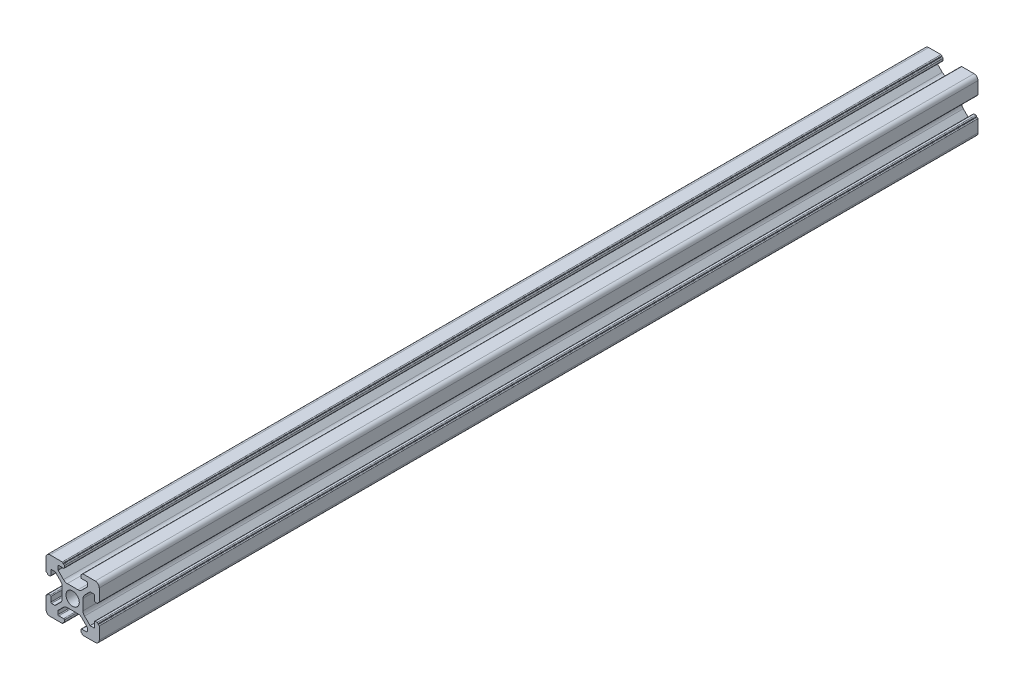
from build123d import *

# Parameters (mm, degrees)
SKETCH_191_R    = 2.5
EXTRUDE_1_DEPTH = 330


with BuildPart() as part:
    # Sketch 191 → 凸台-拉伸1 (new body)
    with BuildSketch(Plane.XY):
        with BuildLine():
            Line((3961.92734864, 92.136143898), (3963.914354409, 94.123149666))
            ThreePointArc((3963.914354409, 94.123149666), (3964.011681414, 94.188181491), (3964.126486443, 94.211017632))
            Line((3964.126486443, 94.211017632), (3965.341562203, 94.211017632))
            ThreePointArc((3965.341562203, 94.211017632), (3965.553694237, 94.123149666), (3965.641562203, 93.911017632))
            Line((3965.641562203, 93.911017632), (3965.641562203, 92.111017631))
            ThreePointArc((3965.641562203, 92.111017631), (3965.729430168, 91.898885597), (3965.941562203, 91.811017632))
            Line((3965.941562203, 91.811017632), (3966.641562203, 91.811017632))
            ThreePointArc((3966.641562203, 91.811017632), (3966.853694237, 91.898885597), (3966.941562203, 92.111017632))
            Line((3966.941562203, 92.111017632), (3966.941562203, 92.311017632))
            Line((3966.941562203, 92.311017632), (3967.141562203, 92.311017632))
            ThreePointArc((3967.141562203, 92.311017632), (3967.353694237, 92.398885597), (3967.441562203, 92.611017632))
            Line((3967.441562203, 92.611017632), (3967.441562203, 97.211017632))
            ThreePointArc((3967.441562203, 97.211017632), (3967.002222375, 98.271677803), (3965.941562203, 98.711017632))
            Line((3965.941562203, 98.711017632), (3961.341562203, 98.711017632))
            ThreePointArc((3961.341562203, 98.711017632), (3961.129430168, 98.623149666), (3961.041562203, 98.411017632))
            Line((3961.041562203, 98.411017632), (3961.041562203, 98.211017632))
            Line((3961.041562203, 98.211017632), (3960.841562203, 98.211017632))
            ThreePointArc((3960.841562203, 98.211017632), (3960.629430168, 98.123149666), (3960.541562203, 97.911017632))
            Line((3960.541562203, 97.911017632), (3960.541562203, 97.211017631))
            ThreePointArc((3960.541562203, 97.211017631), (3960.629430168, 96.998885597), (3960.841562203, 96.911017632))
            Line((3960.841562203, 96.911017632), (3962.641562203, 96.911017632))
            ThreePointArc((3962.641562203, 96.911017632), (3962.853694237, 96.823149666), (3962.941562203, 96.611017632))
            Line((3962.941562203, 96.611017632), (3962.941562203, 95.395941872))
            ThreePointArc((3962.941562203, 95.395941872), (3962.918726063, 95.281136842), (3962.853694237, 95.183809838))
            Line((3962.853694237, 95.183809838), (3960.866688469, 93.196804069))
            ThreePointArc((3960.866688469, 93.196804069), (3960.217841771, 92.763258567), (3959.452474906, 92.611017632))
            Line((3959.452474906, 92.611017632), (3955.430649499, 92.611017632))
            ThreePointArc((3955.430649499, 92.611017632), (3954.665282635, 92.763258567), (3954.016435937, 93.196804069))
            Line((3954.016435937, 93.196804069), (3952.029430168, 95.183809838))
            ThreePointArc((3952.029430168, 95.183809838), (3951.964398343, 95.281136842), (3951.941562203, 95.395941872))
            Line((3951.941562203, 95.395941872), (3951.941562203, 96.611017632))
            ThreePointArc((3951.941562203, 96.611017632), (3952.029430168, 96.823149666), (3952.241562203, 96.911017632))
            Line((3952.241562203, 96.911017632), (3954.041562203, 96.911017632))
            ThreePointArc((3954.041562203, 96.911017632), (3954.253694237, 96.998885597), (3954.341562203, 97.211017631))
            Line((3954.341562203, 97.211017631), (3954.341562203, 97.911017632))
            ThreePointArc((3954.341562203, 97.911017632), (3954.253694237, 98.123149666), (3954.041562203, 98.211017632))
            Line((3954.041562203, 98.211017632), (3953.841562203, 98.211017632))
            Line((3953.841562203, 98.211017632), (3953.841562203, 98.411017632))
            ThreePointArc((3953.841562203, 98.411017632), (3953.753694237, 98.623149666), (3953.541562203, 98.711017632))
            Line((3953.541562203, 98.711017632), (3948.941562203, 98.711017632))
            ThreePointArc((3948.941562203, 98.711017632), (3947.880902031, 98.271677803), (3947.441562203, 97.211017632))
            Line((3947.441562203, 97.211017632), (3947.441562203, 92.611017632))
            ThreePointArc((3947.441562203, 92.611017632), (3947.529430168, 92.398885597), (3947.741562203, 92.311017632))
            Line((3947.741562203, 92.311017632), (3947.941562203, 92.311017632))
            Line((3947.941562203, 92.311017632), (3947.941562203, 92.111017632))
            ThreePointArc((3947.941562203, 92.111017632), (3948.029430168, 91.898885597), (3948.241562203, 91.811017632))
            Line((3948.241562203, 91.811017632), (3948.941562203, 91.811017632))
            ThreePointArc((3948.941562203, 91.811017632), (3949.153694237, 91.898885597), (3949.241562203, 92.111017632))
            Line((3949.241562203, 92.111017632), (3949.241562203, 93.911017632))
            ThreePointArc((3949.241562203, 93.911017632), (3949.329430168, 94.123149666), (3949.541562203, 94.211017632))
            Line((3949.541562203, 94.211017632), (3950.756637962, 94.211017632))
            ThreePointArc((3950.756637962, 94.211017632), (3950.871442992, 94.188181491), (3950.968769997, 94.123149666))
            Line((3950.968769997, 94.123149666), (3952.955775765, 92.136143898))
            ThreePointArc((3952.955775765, 92.136143898), (3953.389321268, 91.4872972), (3953.541562203, 90.721930335))
            Line((3953.541562203, 90.721930335), (3953.541562203, 86.700104928))
            ThreePointArc((3953.541562203, 86.700104928), (3953.389321268, 85.934738063), (3952.955775765, 85.285891366))
            Line((3952.955775765, 85.285891366), (3950.968769997, 83.298885597))
            ThreePointArc((3950.968769997, 83.298885597), (3950.871442992, 83.233853772), (3950.756637962, 83.211017632))
            Line((3950.756637962, 83.211017632), (3949.541562203, 83.211017632))
            ThreePointArc((3949.541562203, 83.211017632), (3949.329430168, 83.298885597), (3949.241562203, 83.511017632))
            Line((3949.241562203, 83.511017632), (3949.241562203, 85.311017632))
            ThreePointArc((3949.241562203, 85.311017632), (3949.153694237, 85.523149666), (3948.941562203, 85.611017632))
            Line((3948.941562203, 85.611017632), (3948.241562203, 85.611017632))
            ThreePointArc((3948.241562203, 85.611017632), (3948.029430168, 85.523149666), (3947.941562203, 85.311017632))
            Line((3947.941562203, 85.311017632), (3947.941562203, 85.111017632))
            Line((3947.941562203, 85.111017632), (3947.741562203, 85.111017632))
            ThreePointArc((3947.741562203, 85.111017632), (3947.529430168, 85.023149666), (3947.441562203, 84.811017632))
            Line((3947.441562203, 84.811017632), (3947.441562203, 80.211017632))
            ThreePointArc((3947.441562203, 80.211017632), (3947.880902031, 79.15035746), (3948.941562203, 78.711017632))
            Line((3948.941562203, 78.711017632), (3953.541562203, 78.711017632))
            ThreePointArc((3953.541562203, 78.711017632), (3953.753694237, 78.798885597), (3953.841562203, 79.011017632))
            ThreePointArc((3953.841562203, 79.011017632), (3953.900140847, 79.152438988), (3954.041562203, 79.211017632))
            ThreePointArc((3954.041562203, 79.211017632), (3954.253694237, 79.298885597), (3954.341562203, 79.511017632))
            Line((3954.341562203, 79.511017632), (3954.341562203, 80.211017632))
            ThreePointArc((3954.341562203, 80.211017632), (3954.253694237, 80.423149666), (3954.041562203, 80.511017632))
            Line((3954.041562203, 80.511017632), (3952.241562203, 80.511017632))
            ThreePointArc((3952.241562203, 80.511017632), (3952.029430168, 80.598885597), (3951.941562203, 80.811017632))
            Line((3951.941562203, 80.811017632), (3951.941562203, 82.026093391))
            ThreePointArc((3951.941562203, 82.026093391), (3951.964398343, 82.140898421), (3952.029430168, 82.238225425))
            Line((3952.029430168, 82.238225425), (3954.016435937, 84.225231194))
            ThreePointArc((3954.016435937, 84.225231194), (3954.665282635, 84.658776697), (3955.4306495, 84.811017632))
            Line((3955.4306495, 84.811017632), (3959.452474906, 84.811017632))
            ThreePointArc((3959.452474906, 84.811017632), (3960.217841771, 84.658776697), (3960.866688469, 84.225231194))
            Line((3960.866688469, 84.225231194), (3962.853694237, 82.238225425))
            ThreePointArc((3962.853694237, 82.238225425), (3962.918726063, 82.140898421), (3962.941562203, 82.026093391))
            Line((3962.941562203, 82.026093391), (3962.941562203, 80.811017632))
            ThreePointArc((3962.941562203, 80.811017632), (3962.853694237, 80.598885597), (3962.641562203, 80.511017632))
            Line((3962.641562203, 80.511017632), (3960.841562203, 80.511017632))
            ThreePointArc((3960.841562203, 80.511017632), (3960.629430168, 80.423149666), (3960.541562203, 80.211017632))
            Line((3960.541562203, 80.211017632), (3960.541562203, 79.511017632))
            ThreePointArc((3960.541562203, 79.511017632), (3960.629430168, 79.298885597), (3960.841562203, 79.211017632))
            ThreePointArc((3960.841562203, 79.211017632), (3960.982983559, 79.152438988), (3961.041562203, 79.011017632))
            ThreePointArc((3961.041562203, 79.011017632), (3961.129430168, 78.798885597), (3961.341562203, 78.711017632))
            Line((3961.341562203, 78.711017632), (3965.941562203, 78.711017632))
            ThreePointArc((3965.941562203, 78.711017632), (3967.002222375, 79.15035746), (3967.441562203, 80.211017632))
            Line((3967.441562203, 80.211017632), (3967.441562203, 84.811017632))
            ThreePointArc((3967.441562203, 84.811017632), (3967.353694237, 85.023149666), (3967.141562203, 85.111017632))
            Line((3967.141562203, 85.111017632), (3966.941562203, 85.111017632))
            Line((3966.941562203, 85.111017632), (3966.941562203, 85.311017632))
            ThreePointArc((3966.941562203, 85.311017632), (3966.853694237, 85.523149666), (3966.641562203, 85.611017632))
            Line((3966.641562203, 85.611017632), (3965.941562203, 85.611017632))
            ThreePointArc((3965.941562203, 85.611017632), (3965.729430168, 85.523149666), (3965.641562203, 85.311017632))
            Line((3965.641562203, 85.311017632), (3965.641562203, 83.511017632))
            ThreePointArc((3965.641562203, 83.511017632), (3965.553694237, 83.298885597), (3965.341562203, 83.211017632))
            Line((3965.341562203, 83.211017632), (3964.002222375, 83.211017632))
            Line((3964.002222375, 83.211017632), (3961.92734864, 85.285891366))
            ThreePointArc((3961.92734864, 85.285891366), (3961.493803138, 85.934738063), (3961.341562203, 86.700104928))
            Line((3961.341562203, 86.700104928), (3961.341562203, 90.721930335))
            ThreePointArc((3961.341562203, 90.721930335), (3961.493803138, 91.4872972), (3961.92734864, 92.136143898))
        make_face()
        with Locations((3957.441562203, 88.711017632)):
            Circle(SKETCH_191_R, mode=Mode.SUBTRACT)
    extrude(amount=EXTRUDE_1_DEPTH)


solid = part.part
